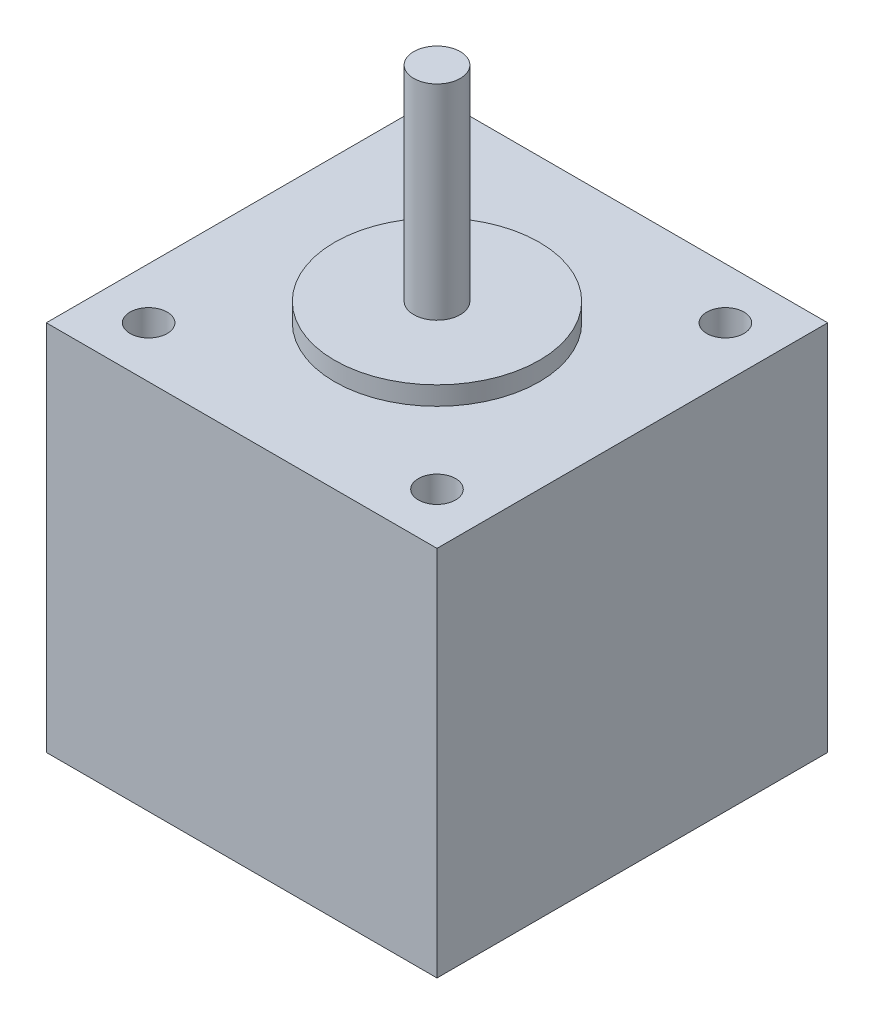
from build123d import *

# Parameters (mm, degrees)
SKETCH1_W           = 42
SKETCH1_H           = 42
BOSS_EXTRUDE1_DEPTH = 40
SKETCH4_R           = 2
CUT_EXTRUDE1_DEPTH  = 4.5
SKETCH2_R           = 11
BOSS_EXTRUDE2_DEPTH = 2
SKETCH3_R           = 2.5
BOSS_EXTRUDE3_DEPTH = 22


with BuildPart() as part:
    # Sketch1 → Boss-Extrude1 (new body)
    with BuildSketch(Plane(origin=(0, 0, 0), x_dir=(1, 0, 0), z_dir=(0, 1, 0))):
        Rectangle(SKETCH1_W, SKETCH1_H)
    extrude(amount=BOSS_EXTRUDE1_DEPTH)

    # Sketch4 → Cut-Extrude1 (cut)
    with BuildSketch(Plane(origin=(0, 40, 0), x_dir=(1, 0, 0), z_dir=(0, 1, 0))):
        with Locations(Location((-15.5, 15.5, 0), (0, 0, 270))):
            Circle(SKETCH4_R)
        with Locations(Location((15.5, 15.5, 0), (0, 0, 270))):
            Circle(SKETCH4_R)
        with Locations(Location((-15.5, -15.5, 0), (0, 0, 270))):
            Circle(SKETCH4_R)
        with Locations(Location((15.5, -15.5, 0), (0, 0, 270))):
            Circle(SKETCH4_R)
    extrude(amount=-CUT_EXTRUDE1_DEPTH, mode=Mode.SUBTRACT)

    # Sketch2 → Boss-Extrude2 (add)
    with BuildSketch(Plane(origin=(0, 40, 0), x_dir=(1, 0, 0), z_dir=(0, 1, 0))):
        with Locations(Location((0, 0, 0), (0, 0, 90))):
            Circle(SKETCH2_R)
    extrude(amount=BOSS_EXTRUDE2_DEPTH)

    # Sketch3 → Boss-Extrude3 (add)
    with BuildSketch(Plane(origin=(0, 42, 0), x_dir=(1, 0, 0), z_dir=(0, 1, 0))):
        with Locations(Location((0, 0, 0), (0, 0, 270))):
            Circle(SKETCH3_R)
    extrude(amount=BOSS_EXTRUDE3_DEPTH)


solid = part.part
